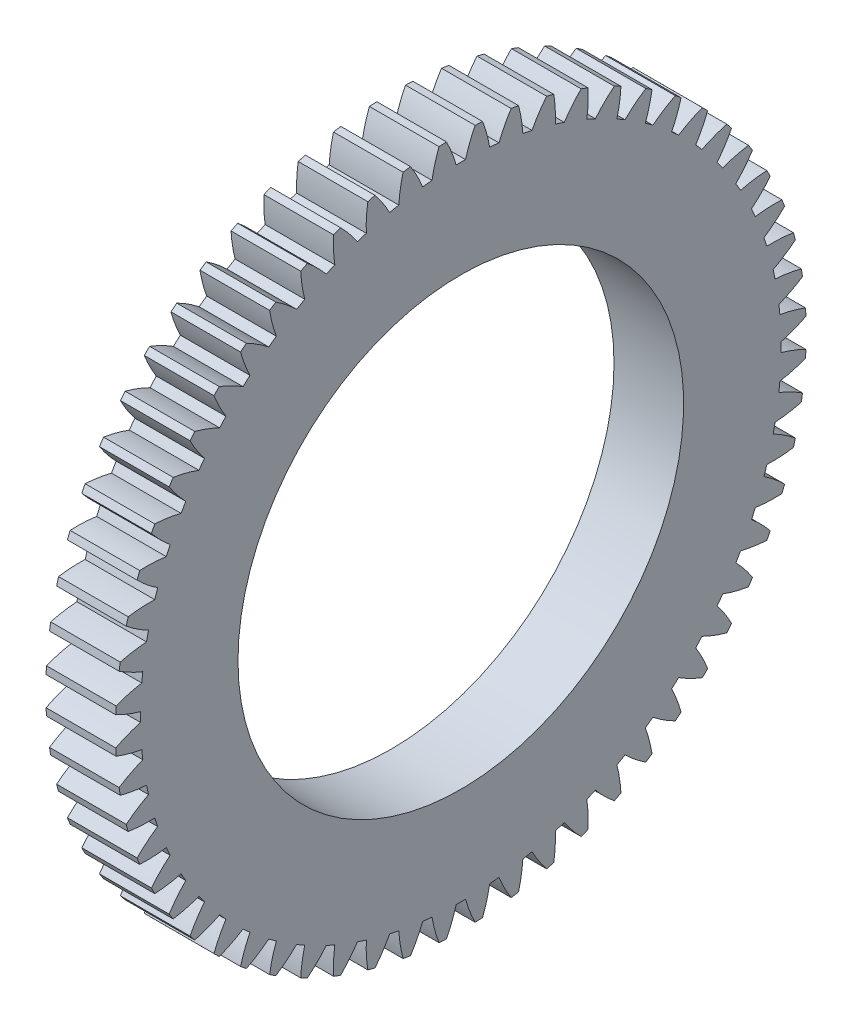
from build123d import *

# Parameters (mm, degrees)
BASPROSKE_W     = 25
BASPROSKE_H     = 124
TOOTHCUT_DEPTH  = 178.135541324
TEETHCUTS_COUNT = 60
TEETHCUTS_ANGLE = 354
BORSKE_R        = 80
BORE_DEPTH      = 50.0000508


with BuildPart() as part:
    # BasProSke → Base-Revolve (revolve)
    with BuildSketch(Plane(origin=(0, 0, 0), x_dir=(1, 0, 0), z_dir=(0, 1, 0)), mode=Mode.PRIVATE) as base_revolve_sk:
        with Locations((12.5, 62)):
            Rectangle(BASPROSKE_W, BASPROSKE_H)
    revolve(base_revolve_sk.sketch.rotate(Axis((-10, 0, 0), (1, 0, 0)), 180), axis=Axis((-10, 0, 0), (1, 0, 0)))

    # TooCutSke → ToothCut (cut, through all)
    with BuildSketch(Plane(origin=(0, 0, 0), x_dir=(0, 0, -1), z_dir=(1, 0, 0))):
        with BuildLine():
            ThreePointArc((1.679508819, 114.986735109), (0, 114.999), (-1.679508819, 114.986735109))
            ThreePointArc((-1.679508819, 114.986735109), (-3.199847673, 119.539525214), (-5.167287996, 123.917710518))
            ThreePointArc((-5.167287996, 123.917710518), (0, 124.0254), (5.167287996, 123.917710518))
            ThreePointArc((5.167287996, 123.917710518), (3.199847673, 119.539525214), (1.679508819, 114.986735109))
        make_face()
    toothcut = extrude(amount=TOOTHCUT_DEPTH, mode=Mode.SUBTRACT)

    # TeethCuts: ToothCut ×60 about axis
    teethcuts_axis = Axis((-10, 0, 0), (1, 0, 0))
    for i in range(1, TEETHCUTS_COUNT):
        add(toothcut.rotate(teethcuts_axis, i * TEETHCUTS_ANGLE / (TEETHCUTS_COUNT - 1)), mode=Mode.SUBTRACT)

    # BorSke → Bore (cut, symmetric)
    with BuildSketch(Plane(origin=(0, 0, 0), x_dir=(0, 0, -1), z_dir=(1, 0, 0))):
        with Locations(Location((0, 0, 0), (0, 0, 180))):
            Circle(BORSKE_R)
    extrude(amount=BORE_DEPTH, both=True, mode=Mode.SUBTRACT)


solid = part.part
